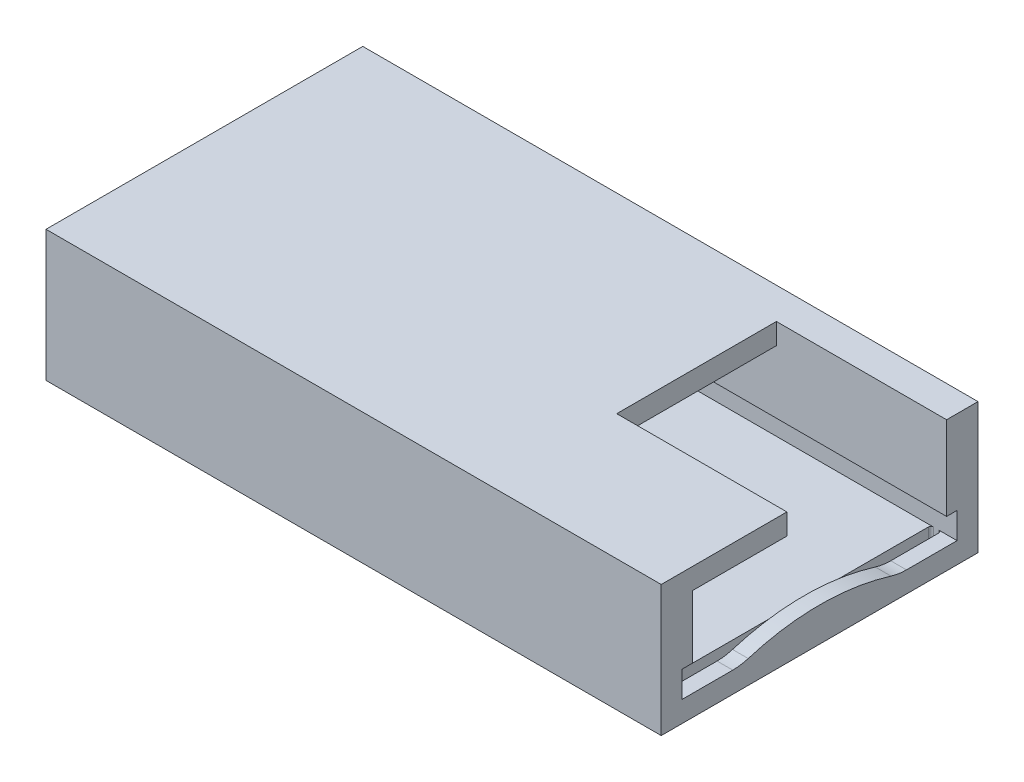
from build123d import *

# Parameters (mm, degrees)
CROQUIS1_W              = 45
CROQUIS1_H              = 24.2
SALIENTE_EXTRUIR1_DEPTH = 10
CORTAR_EXTRUIR2_DEPTH   = 43
CROQUIS4_W              = 9.5
CROQUIS4_H              = 4.8
CORTAR_EXTRUIR3_DEPTH   = 48.659311787
CROQUIS5_W              = 12.2
CROQUIS5_H              = 1.6
CORTAR_EXTRUIR4_DEPTH   = 11
SALIENTE_EXTRUIR2_DEPTH = 2
SALIENTE_EXTRUIR3_DEPTH = 1.2
REDONDEO1_R             = 4
REDONDEO2_R             = 0.2


with BuildPart() as part:
    # Croquis1 → Saliente-Extruir1 (new body)
    with BuildSketch(Plane(origin=(0, 0, 0), x_dir=(1, 0, 0), z_dir=(0, 1, 0))):
        Rectangle(CROQUIS1_W, CROQUIS1_H)
    extrude(amount=SALIENTE_EXTRUIR1_DEPTH)

    # Croquis2 → Cortar-Extruir2 (cut)
    with BuildSketch(Plane(origin=(22.5, 0, 0), x_dir=(0, 0, -1), z_dir=(1, 0, 0))):
        Polygon((10.5, 1.6), (-10.5, 1.6), (-10.5, 3.6), (-9.7, 3.6), (-9.7, 8.4), (9.7, 8.4), (9.7, 3.6), (10.5, 3.6), align=None)
    extrude(amount=-CORTAR_EXTRUIR2_DEPTH, mode=Mode.SUBTRACT)

    # Croquis4 → Cortar-Extruir3 (cut, through all)
    with BuildSketch(Plane(origin=(22.5, 0, 0), x_dir=(0, 0, -1), z_dir=(1, 0, 0))):
        with Locations((2.25, 6)):
            Rectangle(CROQUIS4_W, CROQUIS4_H)
    extrude(amount=-CORTAR_EXTRUIR3_DEPTH, mode=Mode.SUBTRACT)

    # Croquis5 → Cortar-Extruir4 (cut)
    with BuildSketch(Plane(origin=(22.5, 0, 0), x_dir=(0, 0, -1), z_dir=(1, 0, 0))):
        with Locations((3.6, 9.2)):
            Rectangle(CROQUIS5_W, CROQUIS5_H)
    extrude(amount=-CORTAR_EXTRUIR4_DEPTH, mode=Mode.SUBTRACT)

    # Croquis6 → Saliente-Extruir2 (add)
    with BuildSketch(Plane(origin=(22.5, 0, 0), x_dir=(0, 0, -1), z_dir=(1, 0, 0))):
        Polygon((-2.5, 10), (-12.1, 10), (-12.1, 0), (-10.5, 0), (-10.5, 1.6), (-10.5, 3.6), (-9.7, 3.6), (-9.7, 8.4), (-2.5, 8.4), align=None)
        Polygon((12.1, 10), (9.7, 10), (9.7, 3.6), (10.5, 3.6), (10.5, 1.6), (10.5, 0), (12.1, 0), align=None)
    extrude(amount=SALIENTE_EXTRUIR2_DEPTH)

    # Croquis7 → Saliente-Extruir3 (add)
    with BuildSketch(Plane(origin=(24.5, 0, 0), x_dir=(0, 0, -1), z_dir=(1, 0, 0))):
        with BuildLine():
            Line((-10.5, 0), (10.5, 0))
            Line((10.5, 0), (10.5, 1.6))
            Line((10.5, 1.6), (6, 1.6))
            ThreePointArc((6, 1.6), (0, 2.6), (-6, 1.6))
            Line((-6, 1.6), (-10.5, 1.6))
            Line((-10.5, 1.6), (-10.5, 0))
        make_face()
    extrude(amount=-SALIENTE_EXTRUIR3_DEPTH)

    # Redondeo1
    redondeo1_edges = [part.edges().sort_by_distance(p)[0] for p in [
        (23.9, 1.6, 6),
        (23.9, 1.6, -6),
    ]]
    fillet(redondeo1_edges, radius=REDONDEO1_R)

    # Redondeo2
    redondeo2_edges = [part.edges().sort_by_distance(p)[0] for p in [
        (22.5, 0.8, -10.5),
        (23.3, 0.8, 10.5),
        (23.3, 0.8, -10.5),
        (22.5, 0.8, 10.5),
    ]]
    fillet(redondeo2_edges, radius=REDONDEO2_R)


solid = part.part
